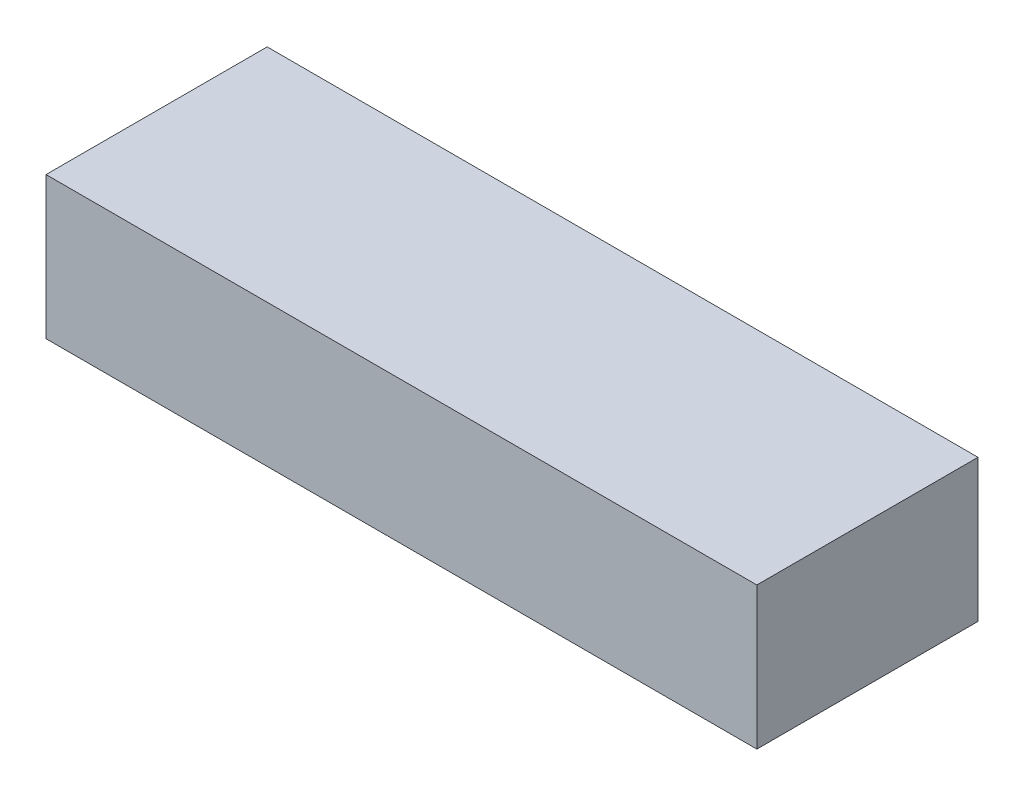
from build123d import *

# Parameters (mm, degrees)
SKETCH1_W           = 135
SKETCH1_H           = 42
BOSS_EXTRUDE1_DEPTH = 27


with BuildPart() as part:
    # Sketch1 → Boss-Extrude1 (new body)
    with BuildSketch(Plane(origin=(0, 0, 0), x_dir=(1, 0, 0), z_dir=(0, 1, 0))):
        with Locations((67.5, 21)):
            Rectangle(SKETCH1_W, SKETCH1_H)
    extrude(amount=BOSS_EXTRUDE1_DEPTH)


solid = part.part
